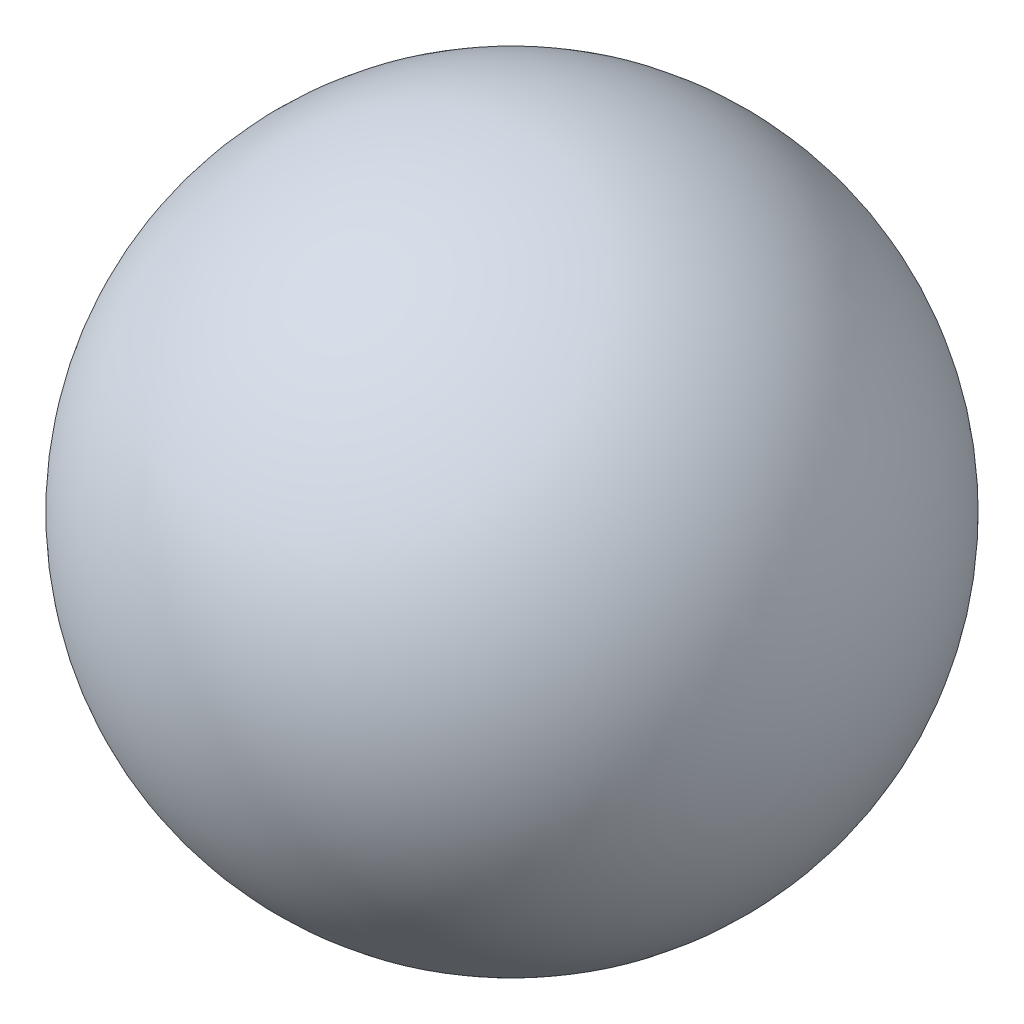
from build123d import *


with BuildPart() as part:
    # Esquisse1 → Révol.-Mince1 (revolve)
    with BuildSketch(Plane.XY):
        with BuildLine():
            ThreePointArc((-23.249281795, 2.844190871), (-3.249281795, 22.844190871), (-23.249281795, 42.844190871))
            Line((-23.249281795, 42.844190871), (-23.249281795, 42.845190871))
            ThreePointArc((-23.249281795, 42.845190871), (-3.248281795, 22.844190871), (-23.249281795, 2.843190871))
            Line((-23.249281795, 2.843190871), (-23.249281795, 2.844190871))
        make_face()
    revolve(axis=Axis((-23.249281795, 2.844190871, 0), (0, 1, 0)))


solid = part.part
